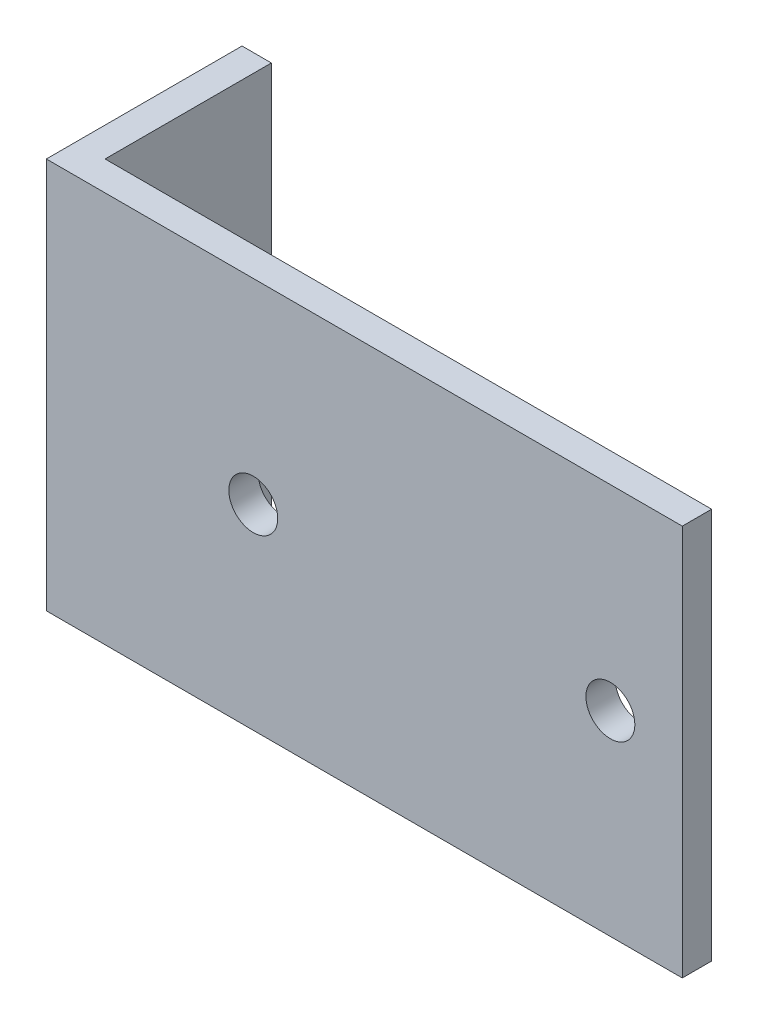
from build123d import *

# Parameters (mm, degrees)
BOSS_EXTRUDE1_DEPTH = 40
SKETCH2_R           = 2.5
CUT_EXTRUDE1_DEPTH  = 79.89866919


with BuildPart() as part:
    # Sketch1 → Boss-Extrude1 (new body)
    with BuildSketch(Plane(origin=(0, 0, 0), x_dir=(1, 0, 0), z_dir=(0, 1, 0))):
        Polygon((0, 0), (0, 20), (3, 20), (3, 3), (65, 3), (65, 0), align=None)
    extrude(amount=BOSS_EXTRUDE1_DEPTH)

    # Sketch2 → Cut-Extrude1 (cut, through all)
    with BuildSketch(Plane.XY):
        with Locations((21.15, 20)):
            Circle(SKETCH2_R)
        with Locations((57.65, 20)):
            Circle(SKETCH2_R)
    extrude(amount=-CUT_EXTRUDE1_DEPTH, mode=Mode.SUBTRACT)


solid = part.part
